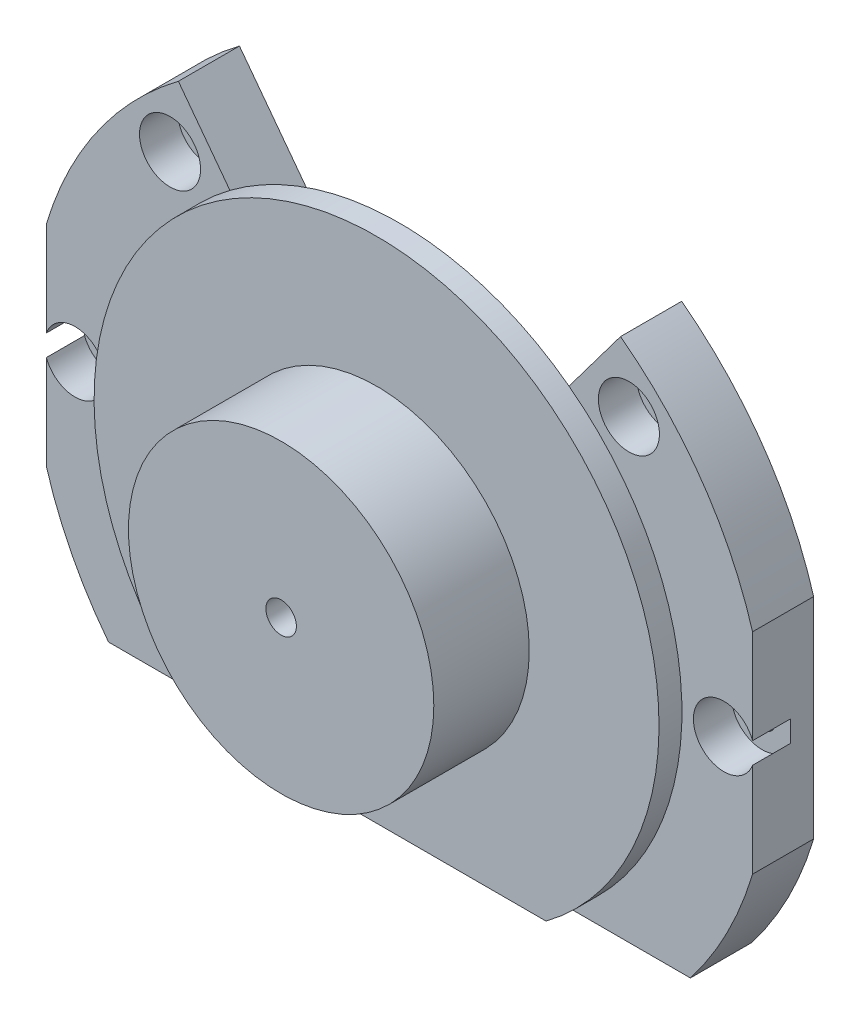
from build123d import *

# Parameters (mm, degrees)
SKETCH1_R           = 48.25
BOSS_EXTRUDE1_DEPTH = 8
SKETCH2_W           = 17.162038191
SKETCH2_H           = 56.822210482
SKETCH2_W_2         = 16.152506533
SKETCH2_H_2         = 65.186901365
CUT_EXTRUDE1_DEPTH  = 8
SKETCH3_R           = 30
CUT_EXTRUDE2_DEPTH  = 8
SKETCH4_R           = 1.75
CUT_EXTRUDE3_DEPTH  = 10
CIRPATTERN1_COUNT   = 8
CUT_EXTRUDE4_DEPTH  = 10
CIRPATTERN2_COUNT   = 2
SKETCH10_R          = 4
CUT_EXTRUDE6_DEPTH  = 5
SKETCH11_R          = 37
BOSS_EXTRUDE2_DEPTH = 3
SKETCH12_R          = 20
BOSS_EXTRUDE3_DEPTH = 12.5
SKETCH13_R          = 2
CUT_EXTRUDE8_DEPTH  = 38
CUT_EXTRUDE9_DEPTH  = 4
SKETCH15_W          = 91.603546033
SKETCH15_H          = 22.115690979
CUT_EXTRUDE10_DEPTH = 34
SKETCH9_R           = 4
CUT_EXTRUDE11_DEPTH = 5
SKETCH16_W          = 4.965700005
SKETCH16_H          = 2.207169135
SKETCH16_W_2        = 4.07415349
BOSS_EXTRUDE4_DEPTH = 8


with BuildPart() as part:
    # Sketch1 → Boss-Extrude1 (new body)
    with BuildSketch(Plane.XY):
        Circle(SKETCH1_R)
    extrude(amount=-BOSS_EXTRUDE1_DEPTH)

    # Sketch2 → Cut-Extrude1 (cut)
    with BuildSketch(Plane.XY):
        with Locations((-54.831019095, 0)):
            Rectangle(SKETCH2_W, SKETCH2_H)
        with Locations((54.326253267, -4.182345442)):
            Rectangle(SKETCH2_W_2, SKETCH2_H_2)
    extrude(amount=-CUT_EXTRUDE1_DEPTH, mode=Mode.SUBTRACT)

    # Sketch3 → Cut-Extrude2 (cut)
    with BuildSketch(Plane.XY):
        Circle(SKETCH3_R)
    extrude(amount=-CUT_EXTRUDE2_DEPTH, mode=Mode.SUBTRACT)

    # Sketch4 → Cut-Extrude3 (cut)
    with BuildSketch(Plane.XY):
        with Locations((-42.5, 0)):
            Circle(SKETCH4_R)
    cut_extrude3 = extrude(amount=-CUT_EXTRUDE3_DEPTH, mode=Mode.SUBTRACT)

    # CirPattern1: Cut-Extrude3 ×8 about axis
    cirpattern1_axis = Axis((0, 0, 0), (0, 0, 1))
    for i in range(1, CIRPATTERN1_COUNT):
        add(cut_extrude3.rotate(cirpattern1_axis, i * 360 / CIRPATTERN1_COUNT), mode=Mode.SUBTRACT)

    # Sketch8 → Cut-Extrude4 (cut)
    with BuildSketch(Plane.XY):
        with BuildLine():
            Line((-28.959547499, 38.59283753), (0, 0))
            Line((0, 0), (28.959547499, 38.59283753))
            ThreePointArc((28.959547499, 38.59283753), (0, 48.25), (-28.959547499, 38.59283753))
        make_face()
    cut_extrude4 = extrude(amount=-CUT_EXTRUDE4_DEPTH, mode=Mode.SUBTRACT)

    # CirPattern2: Cut-Extrude4 ×2 about axis
    cirpattern2_axis = Axis((0, 0, 0), (0, 0, 1))
    for i in range(1, CIRPATTERN2_COUNT):
        add(cut_extrude4.rotate(cirpattern2_axis, i * 360 / CIRPATTERN2_COUNT), mode=Mode.SUBTRACT)

    # Sketch10 → Cut-Extrude6 (cut)
    with BuildSketch(Plane.XY):
        with Locations((42.5, 0)):
            Circle(SKETCH10_R)
        with Locations((30.0520382, 30.0520382)):
            Circle(SKETCH10_R)
    extrude(amount=-CUT_EXTRUDE6_DEPTH, mode=Mode.SUBTRACT)

    # Sketch11 → Boss-Extrude2 (add)
    with BuildSketch(Plane.XY):
        with Locations(Location((0, 0, 0), (0, 0, 126.884070759))):
            Circle(SKETCH11_R)
    extrude(amount=BOSS_EXTRUDE2_DEPTH)

    # Sketch12 → Boss-Extrude3 (add)
    with BuildSketch(Plane.XY.offset(3)):
        Circle(SKETCH12_R)
    extrude(amount=BOSS_EXTRUDE3_DEPTH)

    # Sketch13 → Cut-Extrude8 (cut)
    with BuildSketch(Plane.XY.offset(15.5)):
        Circle(SKETCH13_R)
    extrude(amount=-CUT_EXTRUDE8_DEPTH, mode=Mode.SUBTRACT)

    # Sketch14 → Cut-Extrude9 (cut)
    with BuildSketch(Plane(origin=(0, 0, 0), x_dir=(-1, 0, 0), z_dir=(0, 0, -1))):
        Polygon((-2.020725942, -3.5), (2.020725942, -3.5), (4.041451884, 0), (2.020725942, 3.5), (-2.020725942, 3.5), (-4.041451884, 0), align=None)
    extrude(amount=-CUT_EXTRUDE9_DEPTH, mode=Mode.SUBTRACT)

    # Sketch15 → Cut-Extrude10 (cut)
    with BuildSketch(Plane(origin=(0, 0, -8), x_dir=(-1, 0, 0), z_dir=(0, 0, -1))):
        with Locations((2.592277623, -40.652353026)):
            Rectangle(SKETCH15_W, SKETCH15_H)
    extrude(amount=-CUT_EXTRUDE10_DEPTH, mode=Mode.SUBTRACT)

    # Sketch9 → Cut-Extrude11 (cut)
    with BuildSketch(Plane.XY):
        with Locations((-42.5, 0)):
            Circle(SKETCH9_R)
        with Locations((-30.0520382, 30.0520382)):
            Circle(SKETCH9_R)
    extrude(amount=-CUT_EXTRUDE11_DEPTH, mode=Mode.SUBTRACT)

    # Sketch16 → Boss-Extrude4 (add)
    with BuildSketch(Plane.XY):
        with Locations((-30.845756565, -28.490922969)):
            Rectangle(SKETCH16_W, SKETCH16_H)
        with Locations((29.704093094, -28.490922969)):
            Rectangle(SKETCH16_W_2, SKETCH16_H)
    extrude(amount=-BOSS_EXTRUDE4_DEPTH)


solid = part.part
